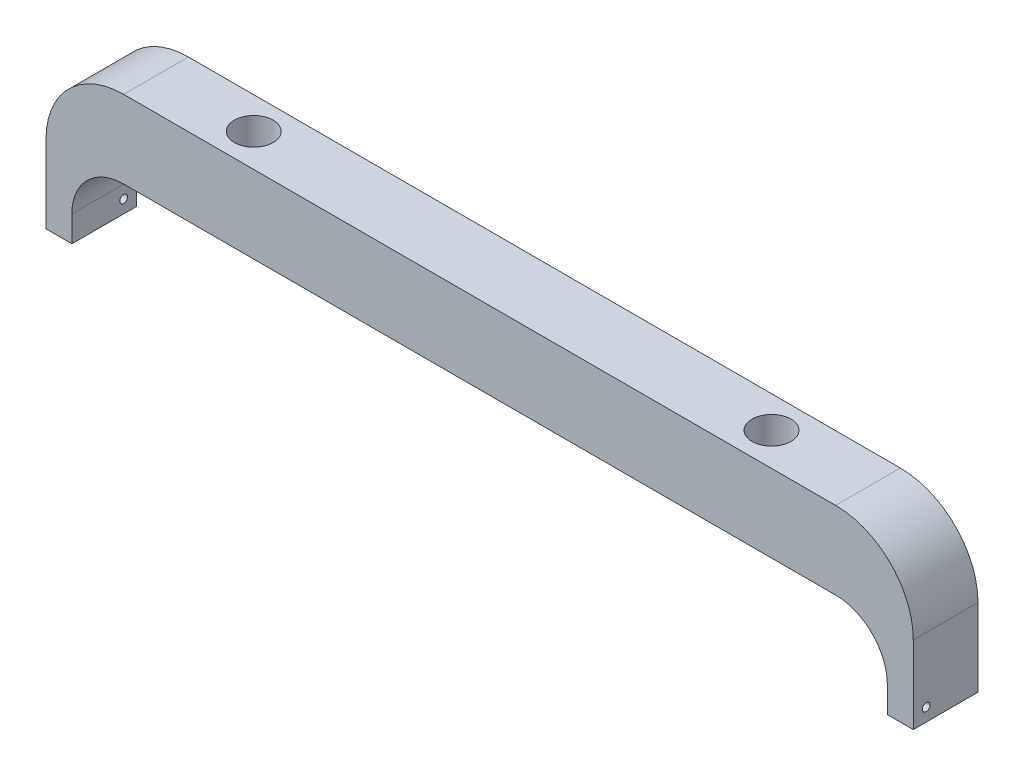
from build123d import *

# Parameters (mm, degrees)
SKETCH2_W           = 55
SKETCH2_H           = 6
BOSS_EXTRUDE8_DEPTH = 5
SKETCH4_R           = 0.3
CUT_EXTRUDE3_DEPTH  = 2
SKETCH5_R           = 0.3
CUT_EXTRUDE4_DEPTH  = 2
SKETCH6_R           = 1.5
CUT_EXTRUDE5_DEPTH  = 10


with BuildPart() as part:
    # Sketch2 → Boss-Extrude8 (new body)
    with BuildSketch(Plane.XY):
        with Locations((0, -3)):
            Rectangle(SKETCH2_W, SKETCH2_H)
        with BuildLine():
            ThreePointArc((-27.5, -6), (-30.328427125, -7.171572875), (-31.5, -10))
            Line((-31.5, -10), (-31.5, -12))
            Line((-31.5, -12), (-33.5, -12))
            Line((-33.5, -12), (-33.5, -6))
            ThreePointArc((-33.5, -6), (-31.742640687, -1.757359313), (-27.5, 0))
            Line((-27.5, 0), (-27.5, -6))
        make_face()
        with BuildLine():
            Line((27.5, -6), (27.5, 0))
            ThreePointArc((27.5, 0), (31.742640687, -1.757359313), (33.5, -6))
            Line((33.5, -6), (33.5, -12))
            Line((33.5, -12), (31.5, -12))
            Line((31.5, -12), (31.5, -10))
            ThreePointArc((31.5, -10), (30.328427125, -7.171572875), (27.5, -6))
        make_face()
    extrude(amount=BOSS_EXTRUDE8_DEPTH)

    # Sketch4 → Cut-Extrude3 (cut)
    with BuildSketch(Plane(origin=(33.5, 0, 0), x_dir=(0, 0, -1), z_dir=(1, 0, 0))):
        with Locations((-4, -11)):
            Circle(SKETCH4_R)
    extrude(amount=-CUT_EXTRUDE3_DEPTH, mode=Mode.SUBTRACT)

    # Sketch5 → Cut-Extrude4 (cut)
    with BuildSketch(Plane.ZY.offset(33.5)):
        with Locations((1, -11)):
            Circle(SKETCH5_R)
    extrude(amount=-CUT_EXTRUDE4_DEPTH, mode=Mode.SUBTRACT)

    # Sketch6 → Cut-Extrude5 (cut)
    with BuildSketch(Plane(origin=(0, 0, 0), x_dir=(1, 0, 0), z_dir=(0, 1, 0))):
        with Locations(Location((-20, -2.45, 0), (0, 0, 270))):
            Circle(SKETCH6_R)
        with Locations(Location((20, -2.45, 0), (0, 0, 270))):
            Circle(SKETCH6_R)
    extrude(amount=-CUT_EXTRUDE5_DEPTH, mode=Mode.SUBTRACT)


solid = part.part
